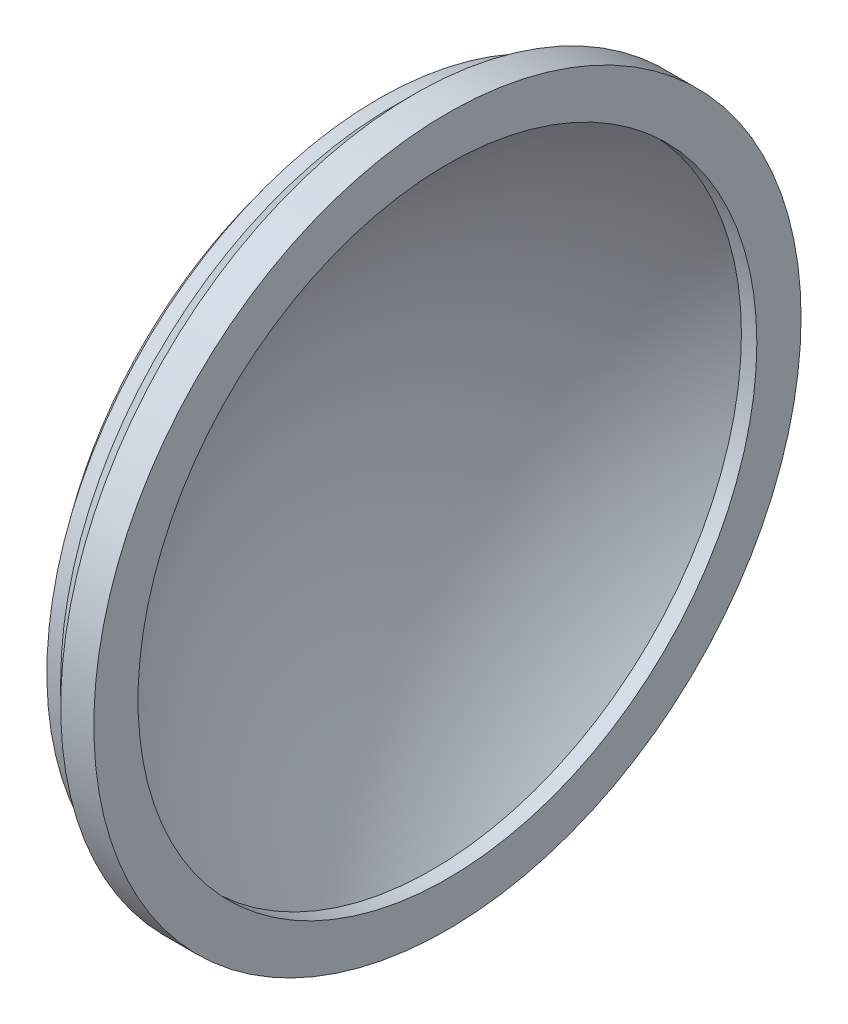
from build123d import *


with BuildPart() as part:
    # Sketch1 → Revolve1 (revolve)
    with BuildSketch(Plane.XY, mode=Mode.PRIVATE) as revolve1_sk:
        with BuildLine():
            Line((-18.790689802, 56), (-16, 56))
            Line((-16, 56), (-16, 64))
            Line((-16, 64), (-22, 64))
            Line((-22, 64), (-26, 60))
            Line((-26, 60), (-28.5, 60))
            ThreePointArc((-28.5, 60), (-44.350112671, 31.841899011), (-49.845400687, 0))
            Line((-49.845400687, 0), (-39.845400687, 0))
            ThreePointArc((-39.845400687, 0), (-34.407796248, 29.913629212), (-18.790689802, 56))
        make_face()
    revolve(revolve1_sk.sketch.rotate(Axis((114.528018661, 0, 0), (-1, 0, 0)), 90), axis=Axis((114.528018661, 0, 0), (-1, 0, 0)))


solid = part.part
